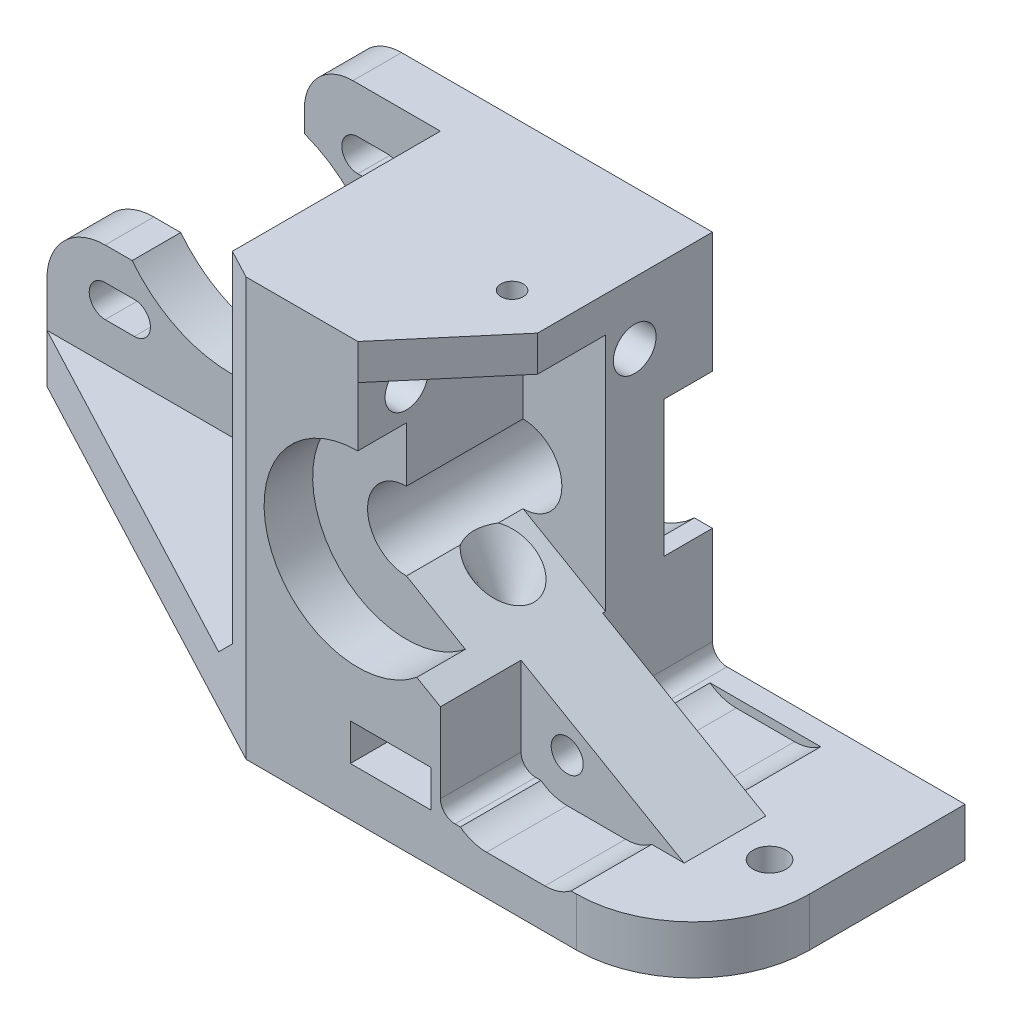
from build123d import *

# Parameters (mm, degrees)
SKETCH1_R                = 4
BOSS_EXTRUDE1_DEPTH      = 28
SKETCH2_W                = 40.5
SKETCH2_H                = 38
CUT_EXTRUDE1_DEPTH       = 23
SKETCH3_R                = 9.65
CUT_EXTRUDE2_DEPTH       = 5
SKETCH8_R                = 1.15
CUT_EXTRUDE7_DEPTH       = 76.219678276
CHAMFER1_SIZE            = 23
CHAMFER1_SIZE2           = 43.5
SKETCH9_R                = 2.2
CUT_EXTRUDE8_DEPTH       = 97.701654612
CUT_EXTRUDE9_DEPTH       = 3
CUT_EXTRUDE9_DEPTH_BACK  = 4
CHAMFER2_SIZE            = 3
SKETCH16_W               = 26
SKETCH16_H               = 38
CUT_EXTRUDE12_DEPTH      = 67.075411541
CUT_EXTRUDE3_START       = -5
CUT_EXTRUDE3_DEPTH       = 5
FILLET6_R                = 1.5
CUT_EXTRUDE13_START      = -17
CUT_EXTRUDE13_DEPTH      = 17
BOSS_EXTRUDE3_DEPTH      = 4.2
BOSS_EXTRUDE3_DEPTH_BACK = 4.2
SKETCH21_R               = 1.65
SKETCH15_R               = 1.7
CUT_EXTRUDE11_DEPTH      = 76.219678276
CUT_EXTRUDE14_DEPTH      = 9
CHAMFER4_SIZE            = 8.5
CHAMFER4_SIZE2           = 10
FILLET1_R                = 5
FILLET2_R                = 6
FILLET4_R                = 12
CUT_EXTRUDE15_DEPTH      = 3.8
CUT_EXTRUDE18_REACH      = 77.22
SKETCH26_R               = 3.15


with BuildPart() as part:
    # Sketch1 → Boss-Extrude1 (new body)
    with BuildSketch(Plane.XY):
        with BuildLine():
            Line((-55, -23.6), (34.5, -23.6))
            Line((34.5, -23.6), (34.5, 19.4))
            Line((34.5, 19.4), (-28.5, 19.4))
            Line((-28.5, 19.4), (-28.5, 12.180409823))
            ThreePointArc((-28.5, 12.180409823), (-20.217668105, -2.285689125), (-33, -12.985083113))
            Line((-33, -12.985083113), (-36, -12.985083113))
            ThreePointArc((-36, -12.985083113), (-41.689100041, -11.672468641), (-46.228019527, -8))
            Line((-46.228019527, -8), (-55, -8))
            Line((-55, -8), (-55, -23.6))
        make_face()
        Circle(SKETCH1_R, mode=Mode.SUBTRACT)
        with BuildLine():
            Line((-23, 11.35), (-20, 11.35))
            ThreePointArc((-20, 11.35), (-18.35, 13), (-20, 14.65))
            Line((-20, 14.65), (-23, 14.65))
            ThreePointArc((-23, 14.65), (-24.65, 13), (-23, 11.35))
        make_face(mode=Mode.SUBTRACT)
        with BuildLine():
            Line((-23, -14.65), (-20, -14.65))
            ThreePointArc((-20, -14.65), (-18.35, -13), (-20, -11.35))
            Line((-20, -11.35), (-23, -11.35))
            ThreePointArc((-23, -11.35), (-24.65, -13), (-23, -14.65))
        make_face(mode=Mode.SUBTRACT)
        with BuildLine():
            Line((-46, -11.35), (-49, -11.35))
            ThreePointArc((-49, -11.35), (-50.65, -13), (-49, -14.65))
            Line((-49, -14.65), (-46, -14.65))
            ThreePointArc((-46, -14.65), (-44.35, -13), (-46, -11.35))
        make_face(mode=Mode.SUBTRACT)
    extrude(amount=BOSS_EXTRUDE1_DEPTH)

    # Sketch2 → Cut-Extrude1 (cut)
    with BuildSketch(Plane.XY.offset(28)):
        with Locations((-34.75, 0.4)):
            Rectangle(SKETCH2_W, SKETCH2_H)
    extrude(amount=-CUT_EXTRUDE1_DEPTH, mode=Mode.SUBTRACT)

    # Sketch3 → Cut-Extrude2 (cut)
    with BuildSketch(Plane.XY.offset(28)):
        Circle(SKETCH3_R)
    extrude(amount=-CUT_EXTRUDE2_DEPTH, mode=Mode.SUBTRACT)

    # Sketch8 → Cut-Extrude7 (cut, through all)
    with BuildSketch(Plane.XZ.offset(23.6)):
        with Locations(Location((3.375, 15.5, 0), (0, 0, 270))):
            Circle(SKETCH8_R)
    extrude(amount=-CUT_EXTRUDE7_DEPTH, mode=Mode.SUBTRACT)

    # Chamfer1
    chamfer1_edges = [part.edges().sort_by_distance(p)[0] for p in [
        (-55, -21.1, 28),
    ]]
    chamfer1_side = [part.faces().sort_by_distance(p)[0] for p in [
        (-55, -18.958031088, 10.841968912),
    ]]
    chamfer(chamfer1_edges, length=CHAMFER1_SIZE, length2=CHAMFER1_SIZE2, reference=chamfer1_side[0])

    # Sketch9 → Cut-Extrude8 (cut, through all)
    with BuildSketch(Plane(origin=(34.5, 0, 0), x_dir=(0, 0, -1), z_dir=(1, 0, 0))):
        with Locations((-8, 13)):
            Circle(SKETCH9_R)
        with Locations((-23, 13)):
            Circle(SKETCH9_R)
    extrude(amount=-CUT_EXTRUDE8_DEPTH, mode=Mode.SUBTRACT)

    # Sketch10 → Cut-Extrude9 (cut, two sides: drawn at the far end of the back side and taken through both)
    with BuildSketch(Plane.ZY.offset(14.5).offset(-CUT_EXTRUDE9_DEPTH_BACK)):
        Polygon((5.1, 14.674315781), (5.1, 11.325684219), (8, 9.651368439), (10.9, 11.325684219), (10.9, 14.674315781), (8, 16.348631561), align=None)
        Polygon((25.9, 11.325684219), (25.9, 14.674315781), (23, 16.348631561), (20.1, 14.674315781), (20.1, 11.325684219), (23, 9.651368439), align=None)
    extrude(amount=CUT_EXTRUDE9_DEPTH + CUT_EXTRUDE9_DEPTH_BACK, mode=Mode.SUBTRACT)

    # Chamfer2
    chamfer2_edges = [part.edges().sort_by_distance(p)[0] for p in [
        (-14.5, -18.6, 15.706896552),
    ]]
    chamfer(chamfer2_edges, length=CHAMFER2_SIZE)

    # Sketch16 → Cut-Extrude12 (cut, through all)
    with BuildSketch(Plane.XY.offset(28)):
        with Locations((21.5, 0.4)):
            Rectangle(SKETCH16_W, SKETCH16_H)
    extrude(amount=-CUT_EXTRUDE12_DEPTH, mode=Mode.SUBTRACT)

    # Sketch4 → Cut-Extrude3 (cut)
    with BuildSketch(Plane(origin=(0, 0, 0), x_dir=(-1, 0, 0), z_dir=(0, 0, -1)).offset(CUT_EXTRUDE3_START)):
        with BuildLine():
            Line((-36.31147183, -7), (-6.642476948, -7))
            ThreePointArc((-6.642476948, -7), (9.65, 0), (-6.642476948, 7))
            Line((-6.642476948, 7), (-36.31147183, 7))
            Line((-36.31147183, 7), (-36.31147183, -7))
        make_face()
    extrude(amount=CUT_EXTRUDE3_DEPTH, mode=Mode.SUBTRACT)

    # Fillet6
    fillet6_edges = [part.edges().sort_by_distance(p)[0] for p in [
        (8.5, -18.6, 14),
    ]]
    fillet(fillet6_edges, radius=FILLET6_R)

    # Sketch17 → Cut-Extrude13 (cut)
    with BuildSketch(Plane.XY.offset(28).offset(CUT_EXTRUDE13_START)):
        with BuildLine():
            Line((0, 4), (0, 15.733500455))
            Line((0, 15.733500455), (8.5, 15.733500455))
            Line((8.5, 15.733500455), (8.5, -8.907477288))
            Line((8.5, -8.907477288), (0, -4))
            ThreePointArc((0, -4), (4, 0), (0, 4))
        make_face()
    extrude(amount=CUT_EXTRUDE13_DEPTH, mode=Mode.SUBTRACT)

    # Sketch20 → Cut-Revolve1 (revolve, cut)
    with BuildSketch(Plane.XY.offset(15.5), mode=Mode.PRIVATE) as cut_revolve1_sk:
        Polygon((3.375, -11.8), (7.375, -3.8), (3.375, -3.8), align=None)
    revolve(cut_revolve1_sk.sketch.rotate(Axis((3.375, -3.8, 15.5), (0, -1, 0)), 270), axis=Axis((3.375, -3.8, 15.5), (0, -1, 0)), mode=Mode.SUBTRACT)

    # Sketch21 → Boss-Extrude3 (add, two sides: drawn at the far end of the back side and taken through both)
    with BuildSketch(Plane.XY.offset(15.5).offset(-BOSS_EXTRUDE3_DEPTH_BACK)):
        Polygon((7.25, -8.185789452), (7.25, -18.6), (25.287941791, -18.6), align=None)
        with Locations((13.25, -15)):
            Circle(SKETCH21_R, mode=Mode.SUBTRACT)
    extrude(amount=BOSS_EXTRUDE3_DEPTH + BOSS_EXTRUDE3_DEPTH_BACK)

    # Sketch15 → Cut-Extrude11 (cut, through all)
    with BuildSketch(Plane.XZ.offset(23.6)):
        with Locations(Location((-20.625, 15, 0), (0, 0, 270))):
            Circle(SKETCH15_R)
        with Locations(Location((29.375, 15, 0), (0, 0, 270))):
            Circle(SKETCH15_R)
    extrude(amount=-CUT_EXTRUDE11_DEPTH, mode=Mode.SUBTRACT)

    # Sketch22 → Cut-Extrude14 (cut)
    with BuildSketch(Plane.XY.offset(19.7)):
        with BuildLine():
            Line((13.25, -19.5), (19.25, -19.5))
            ThreePointArc((19.25, -19.5), (23.75, -15), (19.25, -10.5))
            Line((19.25, -10.5), (13.25, -10.5))
            ThreePointArc((13.25, -10.5), (8.75, -15), (13.25, -19.5))
        make_face()
    cut_extrude14 = extrude(amount=CUT_EXTRUDE14_DEPTH, mode=Mode.SUBTRACT)

    # Mirror1: Cut-Extrude14 across plane
    add(cut_extrude14.mirror(Plane.XY.offset(15.5)), mode=Mode.SUBTRACT)

    # Chamfer4
    chamfer4_edges = [part.edges().sort_by_distance(p)[0] for p in [
        (8.5, 17.566750228, 28),
    ]]
    chamfer4_side = [part.faces().sort_by_distance(p)[0] for p in [
        (7.87031754, -13.003738644, 28),
    ]]
    chamfer(chamfer4_edges, length=CHAMFER4_SIZE, length2=CHAMFER4_SIZE2, reference=chamfer4_side[0])

    # Fillet1
    fillet1_edges = [part.edges().sort_by_distance(p)[0] for p in [
        (-28.5, 19.4, 2.5),
    ]]
    fillet(fillet1_edges, radius=FILLET1_R)

    # Fillet2
    fillet2_edges = [part.edges().sort_by_distance(p)[0] for p in [
        (-55, -8, 2.5),
    ]]
    fillet(fillet2_edges, radius=FILLET2_R)

    # Fillet4
    fillet4_edges = [part.edges().sort_by_distance(p)[0] for p in [
        (34.5, -21.1, 28),
    ]]
    fillet(fillet4_edges, radius=FILLET4_R)

    # Sketch23 → Cut-Extrude15 (cut)
    with BuildSketch(Plane.XZ.offset(18.6)):
        Polygon((-0.775, 28.722034997), (7.525, 28.722034997), (7.525, 13.103996383), (3.375, 10.707992766), (-0.775, 13.103996383), align=None)
    extrude(amount=-CUT_EXTRUDE15_DEPTH, mode=Mode.SUBTRACT)

    # Sketch26 → Cut-Extrude18 (cut, up to next)
    with BuildSketch(Plane.XZ.offset(23.6), mode=Mode.PRIVATE) as cut_extrude18_sk1:
        with Locations(Location((3.375, 15.5, 0), (0, 0, 270))):
            Circle(SKETCH26_R)
    cut_extrude18_tool1 = extrude(cut_extrude18_sk1.sketch, amount=-CUT_EXTRUDE18_REACH, mode=Mode.PRIVATE) & part.part
    add(cut_extrude18_tool1.solids().sort_by_distance((3.375, -23.6, 15.5))[0], mode=Mode.SUBTRACT)


solid = part.part
